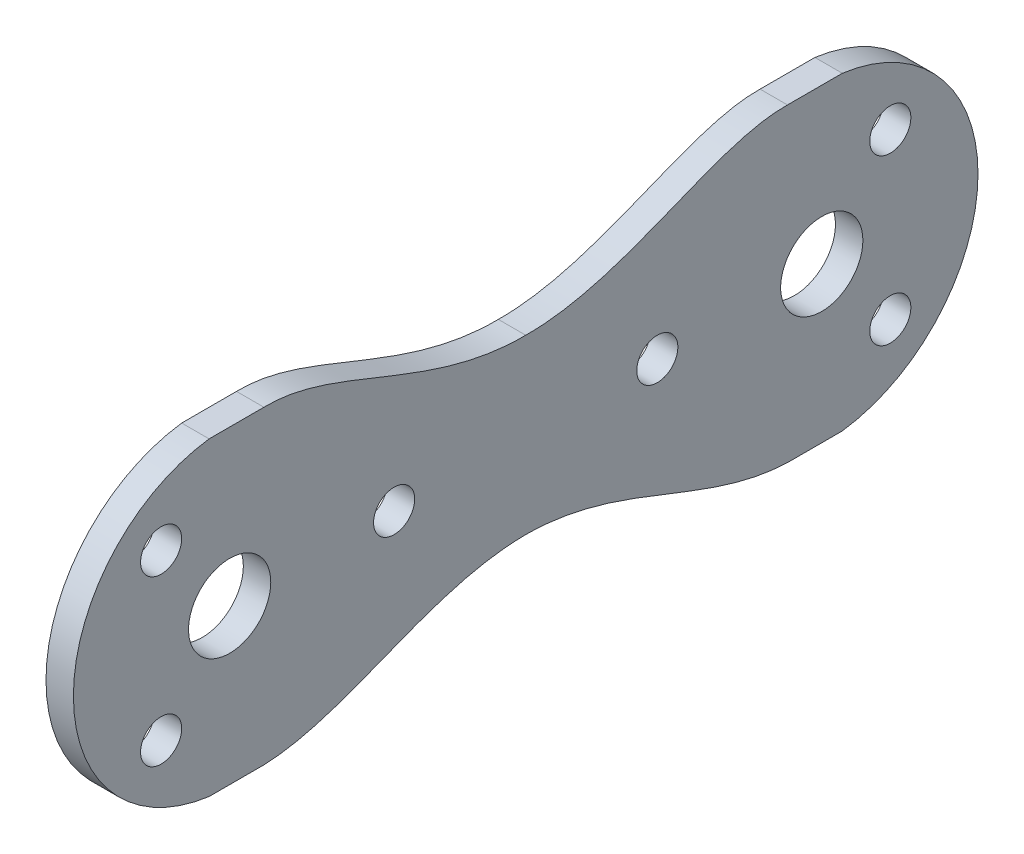
from build123d import *

# Parameters (mm, degrees)
SCHIZZO1_R                   = 1.5
SCHIZZO1_R_2                 = 3
ESTRUSIONE_ESTRUSIONE1_DEPTH = 2


with BuildPart() as part:
    # Schizzo1 → Estrusione-Estrusione1 (new body)
    with BuildSketch(Plane(origin=(0, 0, 0), x_dir=(0, 0, -1), z_dir=(1, 0, 0))):
        with BuildLine():
            Line((-2.501010101, -11.3), (1.498989899, -11.3))
            ThreePointArc((1.498989899, -11.3), (11.398989899, 0), (1.498989899, 11.3))
            Line((1.498989899, 11.3), (-2.501010101, 11.3))
            add(Edge.make_bspline(
                [(-2.501010101, 11.3), (-7.839898951, 11.429610053), (-14.35178918, 6.216652626), (-21.601010101, 6.3)],
                knots=[0, 0, 0, 0, 1, 1, 1, 1], degree=3))
            add(Edge.make_bspline(
                [(-40.701010101, 11.3), (-35.362121251, 11.429610053), (-28.850231022, 6.216652626), (-21.601010101, 6.3)],
                knots=[0, 0, 0, 0, 1, 1, 1, 1], degree=3))
            Line((-40.701010101, 11.3), (-44.701010101, 11.3))
            ThreePointArc((-44.701010101, 11.3), (-54.601010101, 0), (-44.701010101, -11.3))
            Line((-44.701010101, -11.3), (-40.701010101, -11.3))
            add(Edge.make_bspline(
                [(-40.701010101, -11.3), (-34.455779635, -11.063584615), (-28.769360616, -6.33994929), (-21.601010101, -6.3)],
                knots=[0, 0, 0, 0, 1, 1, 1, 1], degree=3))
            add(Edge.make_bspline(
                [(-2.501010101, -11.3), (-8.746240567, -11.063584615), (-14.432659586, -6.33994929), (-21.601010101, -6.3)],
                knots=[0, 0, 0, 0, 1, 1, 1, 1], degree=3))
        make_face()
        with Locations((-48.202020202, 6)):
            Circle(SCHIZZO1_R, mode=Mode.SUBTRACT)
        with Locations((-48.202020202, -6)):
            Circle(SCHIZZO1_R, mode=Mode.SUBTRACT)
        with Locations((-31.202020202, 0)):
            Circle(SCHIZZO1_R, mode=Mode.SUBTRACT)
        with Locations((-12, 0)):
            Circle(SCHIZZO1_R, mode=Mode.SUBTRACT)
        with Locations((5, 6)):
            Circle(SCHIZZO1_R, mode=Mode.SUBTRACT)
        with Locations((5, -6)):
            Circle(SCHIZZO1_R, mode=Mode.SUBTRACT)
        with Locations((-43.202020202, 0)):
            Circle(SCHIZZO1_R_2, mode=Mode.SUBTRACT)
        Circle(SCHIZZO1_R_2, mode=Mode.SUBTRACT)
    extrude(amount=ESTRUSIONE_ESTRUSIONE1_DEPTH)


solid = part.part
